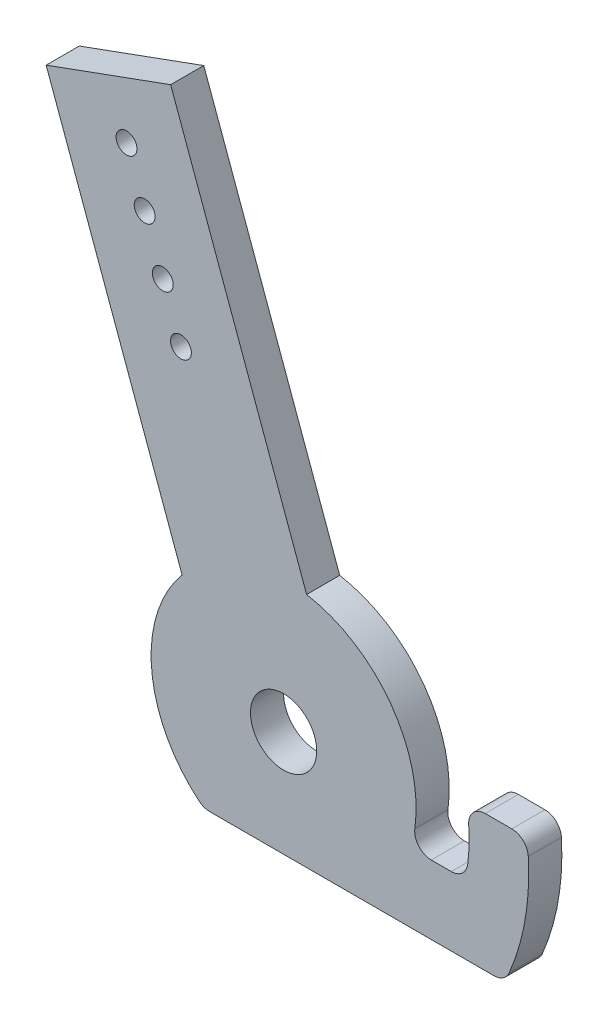
from build123d import *

# Parameters (mm, degrees)
SKETCH1_R           = 1.5875
SKETCH1_R_2         = 0.5
BOSS_EXTRUDE1_DEPTH = 1.5875


with BuildPart() as part:
    # Sketch1 → Boss-Extrude1 (new body)
    with BuildSketch(Plane.XY):
        with BuildLine():
            Line((-11.379865944, 21.982845747), (-5.412817802, 24.154673658))
            Line((-5.412817802, 24.154673658), (1.102665928, 6.253529232))
            ThreePointArc((1.102665928, 6.253529232), (5.134627331, 3.736054359), (6.289441106, -0.874888889))
            ThreePointArc((6.289441106, -0.874888889), (6.476937503, -1.505418725), (7.075621245, -1.778))
            Line((7.075621245, -1.778), (8.036200346, -1.778))
            ThreePointArc((8.036200346, -1.778), (8.562245058, -1.578653923), (8.824063125, -1.080745098))
            ThreePointArc((8.824063125, -1.080745098), (8.886673646, -0.243169696), (8.869960358, 0.596576276))
            ThreePointArc((8.869960358, 0.596576276), (9.082128579, 1.191948731), (9.661921104, 1.443592015))
            Line((9.661921104, 1.443592015), (10.93445675, 1.443592015))
            ThreePointArc((10.93445675, 1.443592015), (11.478819393, 1.227516989), (11.726808688, 0.696932016))
            ThreePointArc((11.726808688, 0.696932016), (11.575475742, -2.003027106), (10.810769922, -4.596847826))
            ThreePointArc((10.810769922, -4.596847826), (10.51820634, -4.948283265), (10.080312495, -5.08))
            Line((10.080312495, -5.08), (-3.53553037, -5.08))
            ThreePointArc((-3.53553037, -5.08), (-3.803866846, -5.033267134), (-4.040606138, -4.898571429))
            ThreePointArc((-4.040606138, -4.898571429), (-6.323450723, -0.58006116), (-4.864382214, 4.081701322))
            Line((-4.864382214, 4.081701322), (-11.379865944, 21.982845747))
        make_face()
        Circle(SKETCH1_R, mode=Mode.SUBTRACT)
        with Locations((-7.527610709, 20.681940446)):
            Circle(SKETCH1_R_2, mode=Mode.SUBTRACT)
        with Locations((-6.658879545, 18.295121189)):
            Circle(SKETCH1_R_2, mode=Mode.SUBTRACT)
        with Locations((-5.790148381, 15.908301932)):
            Circle(SKETCH1_R_2, mode=Mode.SUBTRACT)
        with Locations((-4.921417217, 13.521482675)):
            Circle(SKETCH1_R_2, mode=Mode.SUBTRACT)
    extrude(amount=BOSS_EXTRUDE1_DEPTH)


solid = part.part
